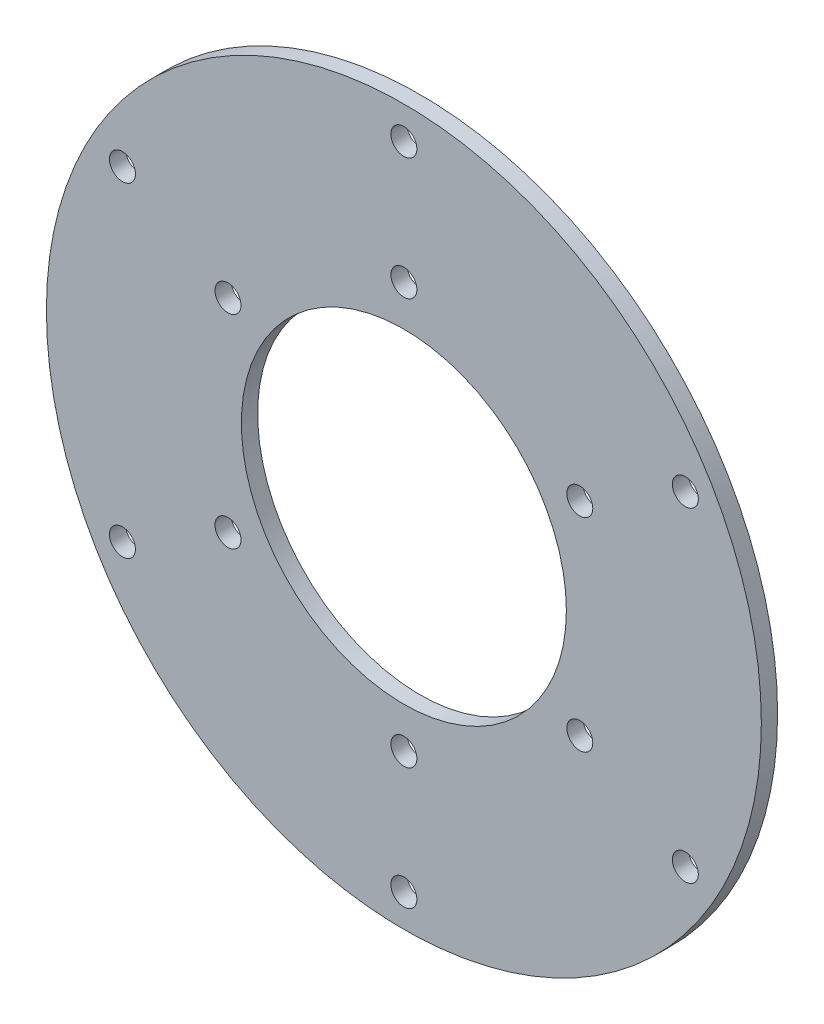
from build123d import *

# Parameters (mm, degrees)
SKETCH_1_R      = 44
SKETCH_1_R_2    = 1.6
SKETCH_1_R_3    = 20
EXTRUDE_1_DEPTH = 2


with BuildPart() as part:
    # 草图1 → 凸台-拉伸1 (new body)
    with BuildSketch(Plane.XY):
        Circle(SKETCH_1_R)
        with Locations((0, 40)):
            Circle(SKETCH_1_R_2, mode=Mode.SUBTRACT)
        with Locations((34.641016151, 20)):
            Circle(SKETCH_1_R_2, mode=Mode.SUBTRACT)
        with Locations((34.641016151, -20)):
            Circle(SKETCH_1_R_2, mode=Mode.SUBTRACT)
        with Locations((0, -40)):
            Circle(SKETCH_1_R_2, mode=Mode.SUBTRACT)
        with Locations((-34.641016151, -20)):
            Circle(SKETCH_1_R_2, mode=Mode.SUBTRACT)
        with Locations((-34.641016151, 20)):
            Circle(SKETCH_1_R_2, mode=Mode.SUBTRACT)
        with Locations((0, 25)):
            Circle(SKETCH_1_R_2, mode=Mode.SUBTRACT)
        with Locations((21.650635095, 12.5)):
            Circle(SKETCH_1_R_2, mode=Mode.SUBTRACT)
        with Locations((21.650635095, -12.5)):
            Circle(SKETCH_1_R_2, mode=Mode.SUBTRACT)
        with Locations((0, -25)):
            Circle(SKETCH_1_R_2, mode=Mode.SUBTRACT)
        with Locations((-21.650635095, -12.5)):
            Circle(SKETCH_1_R_2, mode=Mode.SUBTRACT)
        with Locations((-21.650635095, 12.5)):
            Circle(SKETCH_1_R_2, mode=Mode.SUBTRACT)
        Circle(SKETCH_1_R_3, mode=Mode.SUBTRACT)
    extrude(amount=EXTRUDE_1_DEPTH)


solid = part.part
